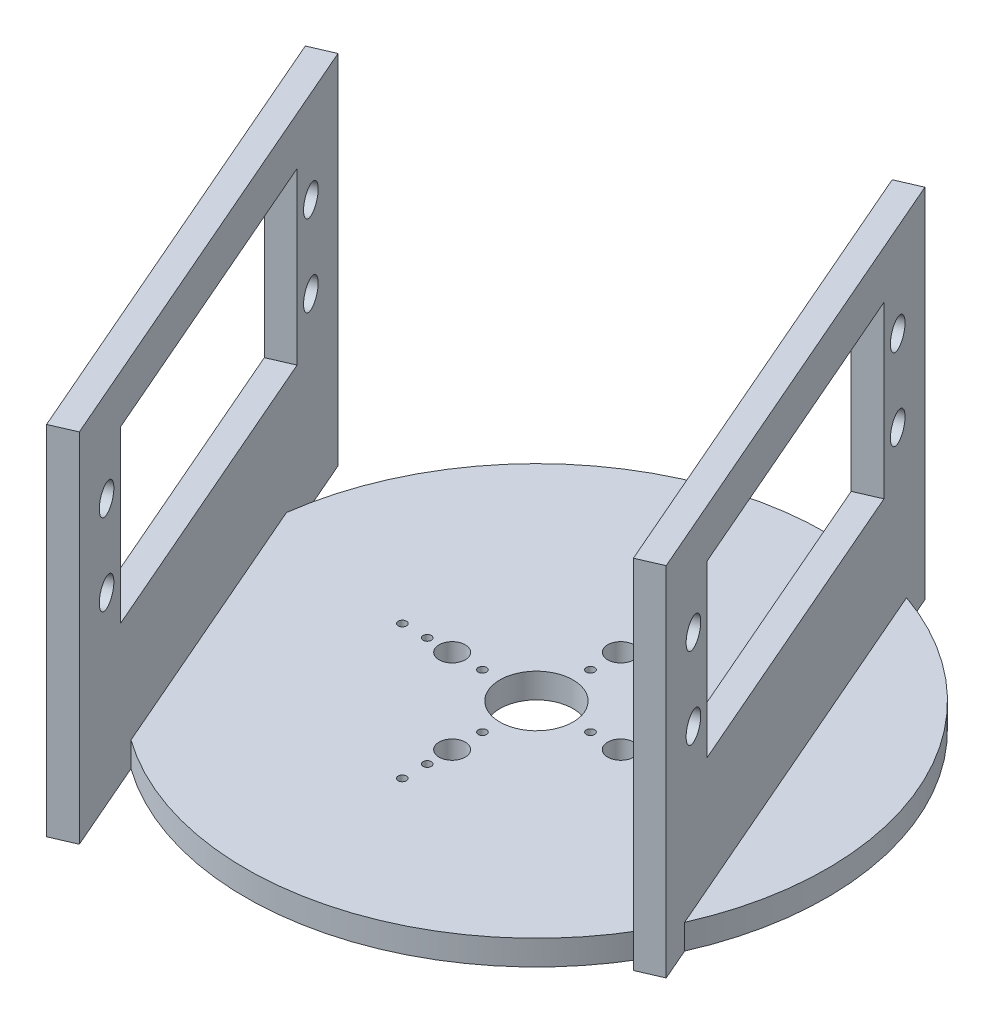
from build123d import *

# Parameters (mm, degrees)
SKETCH1_R           = 0.5
SKETCH1_R_2         = 1.575
BOSS_EXTRUDE1_DEPTH = 3
BOSS_EXTRUDE2_START = 30
SKETCH2_W           = 60
SKETCH2_H           = 40
SKETCH2_R           = 1.689490446
SKETCH2_W_2         = 41
SKETCH2_H_2         = 20.5
BOSS_EXTRUDE2_DEPTH = 3
BOSS_EXTRUDE3_START = -23.72
SKETCH2_2_W         = 60
SKETCH2_2_H         = 40
SKETCH2_2_R         = 1.689490446
SKETCH2_2_W_2       = 41
SKETCH2_2_H_2       = 20.5
BOSS_EXTRUDE3_DEPTH = 3
CUT_EXTRUDE1_DEPTH  = 10


with BuildPart() as part:
    # Sketch1 → Boss-Extrude1 (new body)
    with BuildSketch(Plane(origin=(0, 0, 0), x_dir=(1, 0, 0), z_dir=(0, 1, 0))):
        with BuildLine():
            Line((33.702537367, -18.076984677), (32.005152982, -14.165810341))
            ThreePointArc((32.005152982, -14.165810341), (32.106828614, 13.933827771), (11.51335986, 33.052118612))
            Line((11.51335986, 33.052118612), (9.815975474, 36.963292947))
            Line((9.815975474, 36.963292947), (7.063961593, 35.768964852))
            Line((7.063961593, 35.768964852), (7.77744177, 34.124938088))
            ThreePointArc((7.77744177, 34.124938088), (-19.979563219, 28.73703279), (-34.697157454, 4.594264319))
            Line((-34.697157454, 4.594264319), (-39.463419759, 15.576857865))
            Line((-39.463419759, 15.576857865), (-42.291947314, 14.577141972))
            Line((-42.291947314, 14.577141972), (-34.916382331, -2.417900937))
            ThreePointArc((-34.916382331, -2.417900937), (-32.106828614, -13.933827771), (-25.614551861, -23.85151427))
            Line((-25.614551861, -23.85151427), (-18.322186149, -40.654846416))
            Line((-18.322186149, -40.654846416), (-15.576857865, -39.463419759))
            Line((-15.576857865, -39.463419759), (-20.34312017, -28.480826213))
            ThreePointArc((-20.34312017, -28.480826213), (7.343177958, -34.221013098), (30.237043308, -17.627286007))
            Line((30.237043308, -17.627286007), (30.950523486, -19.271312771))
            Line((30.950523486, -19.271312771), (33.702537367, -18.076984677))
        make_face()
        with Locations(Location((0, -16.15, 0), (0, 0, 270))):
            Circle(SKETCH1_R, mode=Mode.SUBTRACT)
        with BuildLine():
            ThreePointArc((0, -12.65), (0.5, -13.15), (0, -13.65))
            ThreePointArc((0, -13.65), (-0.5, -13.15), (0, -12.65))
        make_face(mode=Mode.SUBTRACT)
        with BuildLine():
            ThreePointArc((0, -8.575), (1.575, -10.15), (0, -11.725))
            ThreePointArc((0, -11.725), (-1.575, -10.15), (0, -8.575))
        make_face(mode=Mode.SUBTRACT)
        with BuildLine():
            ThreePointArc((0, -6.005210608), (0.5, -6.505210608), (0, -7.005210608))
            ThreePointArc((0, -7.005210608), (-0.5, -6.505210608), (0, -6.005210608))
        make_face(mode=Mode.SUBTRACT)
        with BuildLine():
            ThreePointArc((11.725, 0), (10.15, -1.575), (8.575, 0))
            ThreePointArc((8.575, 0), (10.15, 1.575), (11.725, 0))
        make_face(mode=Mode.SUBTRACT)
        with Locations(Location((-16.15, 0, 0), (0, 0, 270))):
            Circle(SKETCH1_R, mode=Mode.SUBTRACT)
        with BuildLine():
            ThreePointArc((-12.65, 0), (-13.15, -0.5), (-13.65, 0))
            ThreePointArc((-13.65, 0), (-13.15, 0.5), (-12.65, 0))
        make_face(mode=Mode.SUBTRACT)
        with Locations(Location((-10.15, 0, 0), (0, 0, 270))):
            Circle(SKETCH1_R_2, mode=Mode.SUBTRACT)
        with Locations(Location((-6.505210608, 0, 0), (0, 0, 270))):
            Circle(SKETCH1_R, mode=Mode.SUBTRACT)
        with BuildLine():
            ThreePointArc((4.401273885, 0), (3.11217061, -3.11217061), (0, -4.401273885))
            ThreePointArc((0, -4.401273885), (-4.401273885, 0), (0, 4.401273885))
            Line((0, 4.401273885), (0, 0))
            Line((0, 0), (4.037455609, 1.752188351))
            ThreePointArc((4.037455609, 1.752188351), (4.309359567, 0.894780386), (4.401273885, 0))
        make_face(mode=Mode.SUBTRACT)
        with BuildLine():
            ThreePointArc((7.005210608, 0), (6.505210608, -0.5), (6.005210608, 0))
            ThreePointArc((6.005210608, 0), (6.505210608, 0.5), (7.005210608, 0))
        make_face(mode=Mode.SUBTRACT)
        with BuildLine():
            ThreePointArc((0, 7.005210608), (0.5, 6.505210608), (0, 6.005210608))
            ThreePointArc((0, 6.005210608), (-0.5, 6.505210608), (0, 7.005210608))
        make_face(mode=Mode.SUBTRACT)
        with BuildLine():
            ThreePointArc((13.65, 0), (13.15, -0.5), (12.65, 0))
            ThreePointArc((12.65, 0), (13.15, 0.5), (13.65, 0))
        make_face(mode=Mode.SUBTRACT)
        with Locations(Location((16.15, 0, 0), (0, 0, 270))):
            Circle(SKETCH1_R, mode=Mode.SUBTRACT)
        with BuildLine():
            ThreePointArc((0, 11.725), (1.575, 10.15), (0, 8.575))
            ThreePointArc((0, 8.575), (-1.575, 10.15), (0, 11.725))
        make_face(mode=Mode.SUBTRACT)
        with BuildLine():
            ThreePointArc((0, 13.65), (0.5, 13.15), (0, 12.65))
            ThreePointArc((0, 12.65), (-0.5, 13.15), (0, 13.65))
        make_face(mode=Mode.SUBTRACT)
        with Locations(Location((0, 16.15, 0), (0, 0, 270))):
            Circle(SKETCH1_R, mode=Mode.SUBTRACT)
    extrude(amount=BOSS_EXTRUDE1_DEPTH)

    # Sketch2 → Boss-Extrude2 (add)
    with BuildSketch(Plane(origin=(0, 0, 0), x_dir=(0.3981093648941227, 0, 0.9173379603960573), z_dir=(-0.9173379603960573, 0, 0.3981093648941227)).offset(BOSS_EXTRUDE2_START)):
        with Locations((0, 23)):
            Rectangle(SKETCH2_W, SKETCH2_H)
        with Locations(Location((-23.689490446, 31.9, 0), (0, 0, 180))):
            Circle(SKETCH2_R, mode=Mode.SUBTRACT)
        with Locations(Location((-23.689490446, 22.1, 0), (0, 0, 180))):
            Circle(SKETCH2_R, mode=Mode.SUBTRACT)
        with Locations(Location((23.689490446, 22.1, 0), (0, 0, 180))):
            Circle(SKETCH2_R, mode=Mode.SUBTRACT)
        with Locations(Location((23.689490446, 31.9, 0), (0, 0, 180))):
            Circle(SKETCH2_R, mode=Mode.SUBTRACT)
        with Locations((0, 27)):
            Rectangle(SKETCH2_W_2, SKETCH2_H_2, mode=Mode.SUBTRACT)
    extrude(amount=BOSS_EXTRUDE2_DEPTH)

    # Sketch2<2> → Boss-Extrude3 (add)
    with BuildSketch(Plane(origin=(0, 0, 0), x_dir=(0.3981093648941227, 0, 0.9173379603960573), z_dir=(-0.9173379603960573, 0, 0.3981093648941227)).offset(BOSS_EXTRUDE3_START)):
        with Locations((0, 23)):
            Rectangle(SKETCH2_2_W, SKETCH2_2_H)
        with Locations(Location((-23.689490446, 31.9, 0), (0, 0, 180))):
            Circle(SKETCH2_2_R, mode=Mode.SUBTRACT)
        with Locations(Location((-23.689490446, 22.1, 0), (0, 0, 180))):
            Circle(SKETCH2_2_R, mode=Mode.SUBTRACT)
        with Locations(Location((23.689490446, 22.1, 0), (0, 0, 180))):
            Circle(SKETCH2_2_R, mode=Mode.SUBTRACT)
        with Locations(Location((23.689490446, 31.9, 0), (0, 0, 180))):
            Circle(SKETCH2_2_R, mode=Mode.SUBTRACT)
        with Locations((0, 27)):
            Rectangle(SKETCH2_2_W_2, SKETCH2_2_H_2, mode=Mode.SUBTRACT)
    extrude(amount=BOSS_EXTRUDE3_DEPTH)

    # Sketch1<3> → Cut-Extrude1 (cut)
    with BuildSketch(Plane(origin=(0, 0, 0), x_dir=(1, 0, 0), z_dir=(0, 1, 0))):
        with BuildLine():
            Line((0, 1.313954222), (0, 0))
            Line((0, 0), (4.037455609, 1.752188351))
            ThreePointArc((4.037455609, 1.752188351), (2.414472094, 3.679882651), (0, 4.401273885))
            Line((0, 4.401273885), (0, 1.313954222))
        make_face()
    extrude(amount=CUT_EXTRUDE1_DEPTH, mode=Mode.SUBTRACT)


solid = part.part
